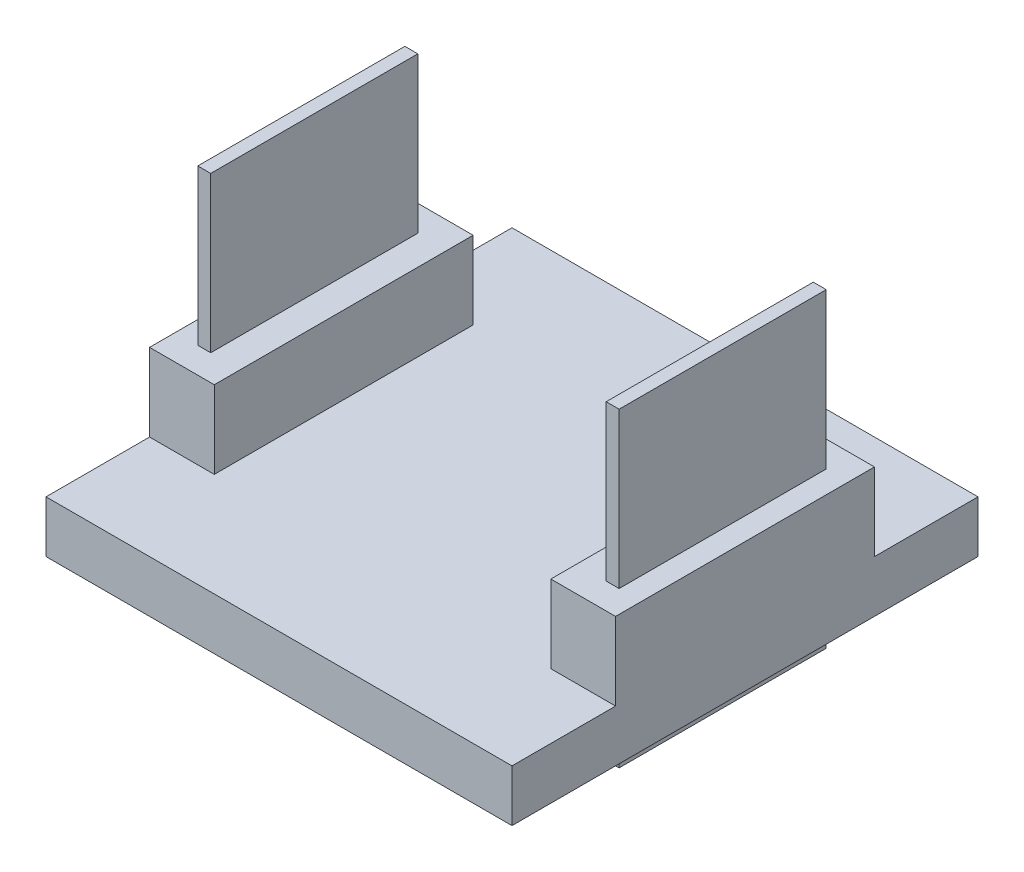
from build123d import *

# Parameters (mm, degrees)
SKETCH1_W                = 18
SKETCH1_H                = 18
BOSS_EXTRUDE1_DEPTH      = 2
SKETCH2_W                = 2.5
SKETCH2_H                = 10
BOSS_EXTRUDE2_DEPTH      = 3
BOSS_EXTRUDE3_DEPTH      = 6
BOSS_EXTRUDE3_DEPTH_BACK = 6
SKETCH3_W                = 0.5
SKETCH3_H                = 8


with BuildPart() as part:
    # Sketch1 → Boss-Extrude1 (new body)
    with BuildSketch(Plane(origin=(0, 0, 0), x_dir=(1, 0, 0), z_dir=(0, 1, 0))):
        Rectangle(SKETCH1_W, SKETCH1_H)
    extrude(amount=BOSS_EXTRUDE1_DEPTH)

    # Sketch2 → Boss-Extrude2 (add)
    with BuildSketch(Plane(origin=(0, 2, 0), x_dir=(1, 0, 0), z_dir=(0, 1, 0))):
        with Locations((-7.75, 0)):
            Rectangle(SKETCH2_W, SKETCH2_H)
        with Locations((7.75, 0)):
            Rectangle(SKETCH2_W, SKETCH2_H)
    extrude(amount=BOSS_EXTRUDE2_DEPTH)

    # Sketch3 → Boss-Extrude3 (add, two sides: drawn at the far end of the back side and taken through both)
    with BuildSketch(Plane(origin=(0, 5, 0), x_dir=(1, 0, 0), z_dir=(0, 1, 0)).offset(-BOSS_EXTRUDE3_DEPTH_BACK)):
        with Locations((-7.887555613, 0)):
            Rectangle(SKETCH3_W, SKETCH3_H)
        with Locations((7.887555613, 0)):
            Rectangle(SKETCH3_W, SKETCH3_H)
    extrude(amount=BOSS_EXTRUDE3_DEPTH + BOSS_EXTRUDE3_DEPTH_BACK)


solid = part.part
